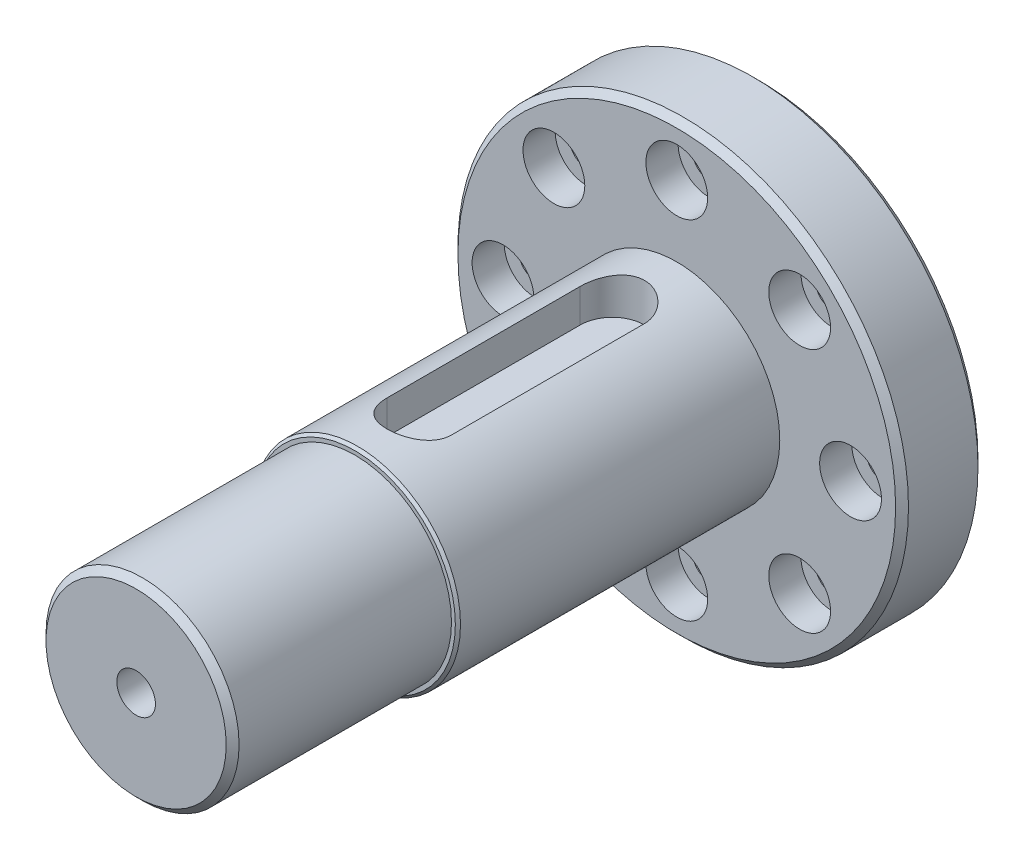
from build123d import *

# Parameters (mm, degrees)
SKETCH_1_R          = 17.5
SKETCH_1_R_2        = 1.25
EXTRUDE_1_DEPTH     = 6.4
SKETCH_2_R          = 8
EXTRUDE_2_DEPTH     = 42
CUT_EXTRUDE_1_DEPTH = 3
SKETCH_11_R         = 1.5
CUT_EXTRUDE_4_DEPTH = 5
SKETCH_12_OUTSIDE_W = 50.846
SKETCH_12_OUTSIDE_H = 50.846
SKETCH_12_OUTSIDE_R = 7.5
CUT_EXTRUDE_5_DEPTH = 17
CHAMFER_1_SIZE      = 0.5
CHAMFER_2_SIZE      = 0.2
SKETCH_39_R         = 2.4
CUT_EXTRUDE_8_DEPTH = 2.5
CHAMFER_3_SIZE      = 0.5
SKETCH_40_R         = 10.5
CUT_EXTRUDE_9_DEPTH = 2
CHAMFER_4_SIZE      = 0.5


with BuildPart() as part:
    # 草图1 → 凸台-拉伸1 (new body)
    with BuildSketch(Plane.XY):
        Circle(SKETCH_1_R)
        with Locations((0, 13.5)):
            Circle(SKETCH_1_R_2, mode=Mode.SUBTRACT)
        with Locations((9.545941546, 9.545941546)):
            Circle(SKETCH_1_R_2, mode=Mode.SUBTRACT)
        with Locations((13.5, 0)):
            Circle(SKETCH_1_R_2, mode=Mode.SUBTRACT)
        with Locations((9.545941546, -9.545941546)):
            Circle(SKETCH_1_R_2, mode=Mode.SUBTRACT)
        with Locations((0, -13.5)):
            Circle(SKETCH_1_R_2, mode=Mode.SUBTRACT)
        with Locations((-9.545941546, -9.545941546)):
            Circle(SKETCH_1_R_2, mode=Mode.SUBTRACT)
        with Locations((-13.5, 0)):
            Circle(SKETCH_1_R_2, mode=Mode.SUBTRACT)
        with Locations((-9.545941546, 9.545941546)):
            Circle(SKETCH_1_R_2, mode=Mode.SUBTRACT)
    extrude(amount=EXTRUDE_1_DEPTH)

    # 草图2 → 凸台-拉伸2 (add)
    with BuildSketch(Plane.XY.offset(6.4)):
        with Locations(Location((0, 0, 0), (0, 0, 180))):
            Circle(SKETCH_2_R)
    extrude(amount=EXTRUDE_2_DEPTH)

    # 草图6 → 切除-拉伸1 (cut)
    with BuildSketch(Plane(origin=(0, 8, 0), x_dir=(1, 0, 0), z_dir=(0, 1, 0))):
        with BuildLine():
            Line((-2.5, -11.4), (-2.5, -26.4))
            ThreePointArc((-2.5, -26.4), (0, -28.9), (2.5, -26.4))
            Line((2.5, -26.4), (2.5, -11.4))
            ThreePointArc((2.5, -11.4), (0, -8.9), (-2.5, -11.4))
        make_face()
    extrude(amount=-CUT_EXTRUDE_1_DEPTH, mode=Mode.SUBTRACT)

    # 草图11 → 切除-拉伸4 (cut)
    with BuildSketch(Plane.XY.offset(48.4)):
        Circle(SKETCH_11_R)
    extrude(amount=-CUT_EXTRUDE_4_DEPTH, mode=Mode.SUBTRACT)

    # 草图12 outside → 切除-拉伸5 (cut)
    with BuildSketch(Plane.XY.offset(48.4)):
        Rectangle(SKETCH_12_OUTSIDE_W, SKETCH_12_OUTSIDE_H)
        Circle(SKETCH_12_OUTSIDE_R, mode=Mode.SUBTRACT)
    extrude(amount=-CUT_EXTRUDE_5_DEPTH, mode=Mode.SUBTRACT)

    # 倒角1
    chamfer_1_edges = [part.edges().sort_by_distance(p)[0] for p in [
        (-7.5, 0, 48.4),
    ]]
    chamfer(chamfer_1_edges, length=CHAMFER_1_SIZE)

    # 倒角2
    chamfer_2_edges = [part.edges().sort_by_distance(p)[0] for p in [
        (8, 0, 31.4),
    ]]
    chamfer(chamfer_2_edges, length=CHAMFER_2_SIZE)

    # 草图39 → 切除-拉伸8 (cut)
    with BuildSketch(Plane.XY.offset(6.4)):
        with Locations((-9.545941546, 9.545941546)):
            Circle(SKETCH_39_R)
        with Locations((0, 13.5)):
            Circle(SKETCH_39_R)
        with Locations((9.545941546, 9.545941546)):
            Circle(SKETCH_39_R)
        with Locations((13.5, 0)):
            Circle(SKETCH_39_R)
        with Locations((9.545941546, -9.545941546)):
            Circle(SKETCH_39_R)
        with Locations((0, -13.5)):
            Circle(SKETCH_39_R)
        with Locations((-9.545941546, -9.545941546)):
            Circle(SKETCH_39_R)
        with Locations((-13.5, 0)):
            Circle(SKETCH_39_R)
    extrude(amount=-CUT_EXTRUDE_8_DEPTH, mode=Mode.SUBTRACT)

    # 倒角3
    chamfer_3_edges = [part.edges().sort_by_distance(p)[0] for p in [
        (-17.5, 0, 0),
        (-17.5, 0, 6.4),
    ]]
    chamfer(chamfer_3_edges, length=CHAMFER_3_SIZE)

    # 草图40 → 切除-拉伸9 (cut)
    with BuildSketch(Plane(origin=(0, 0, 0), x_dir=(-1, 0, 0), z_dir=(0, 0, -1))):
        Circle(SKETCH_40_R)
    extrude(amount=-CUT_EXTRUDE_9_DEPTH, mode=Mode.SUBTRACT)

    # 倒角4
    chamfer_4_edges = [part.edges().sort_by_distance(p)[0] for p in [
        (10.5, 0, 0),
    ]]
    chamfer(chamfer_4_edges, length=CHAMFER_4_SIZE)


solid = part.part
